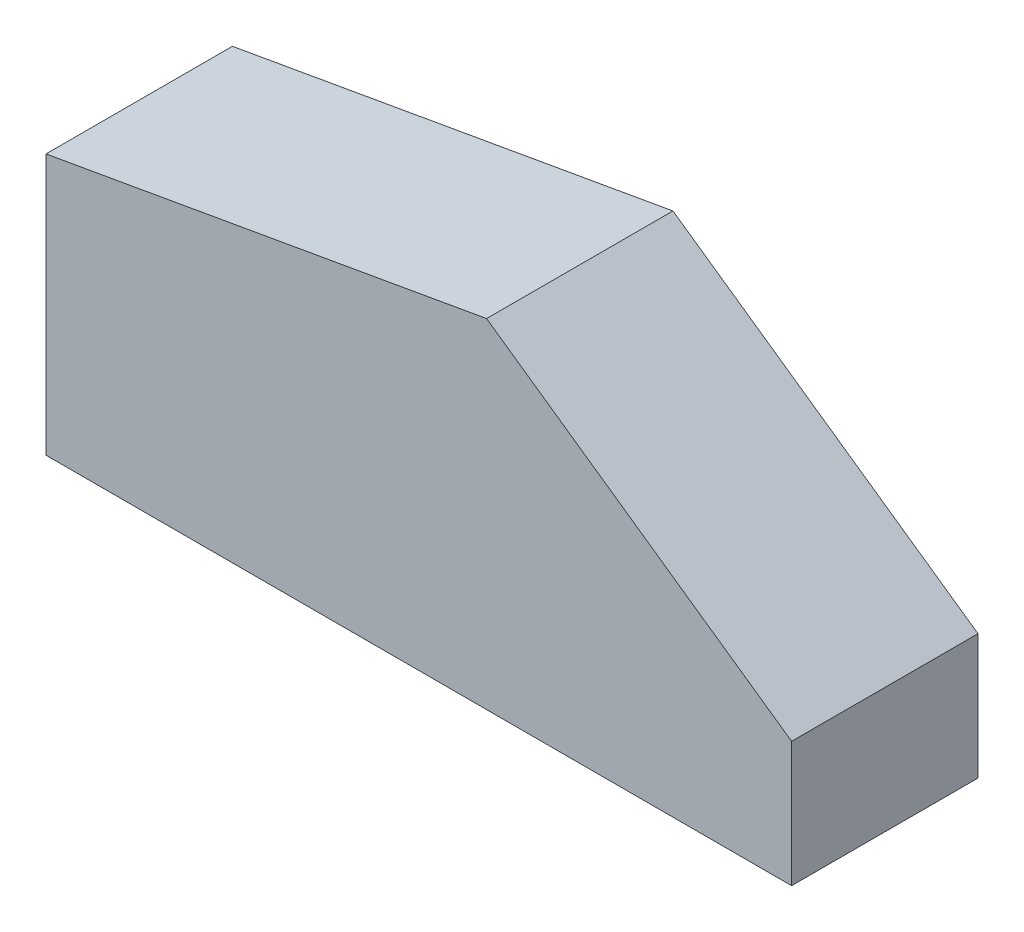
from build123d import *

# Parameters (mm, degrees)
BOSS_EXTRUDE1_DEPTH = 25


with BuildPart() as part:
    # Sketch2 → Boss-Extrude1 (new body)
    with BuildSketch(Plane.XY):
        Polygon((0, 0), (100, 0), (100, 16.77232558), (59.088465181, 45.41889066), (0, 35), align=None)
    extrude(amount=BOSS_EXTRUDE1_DEPTH)


solid = part.part
